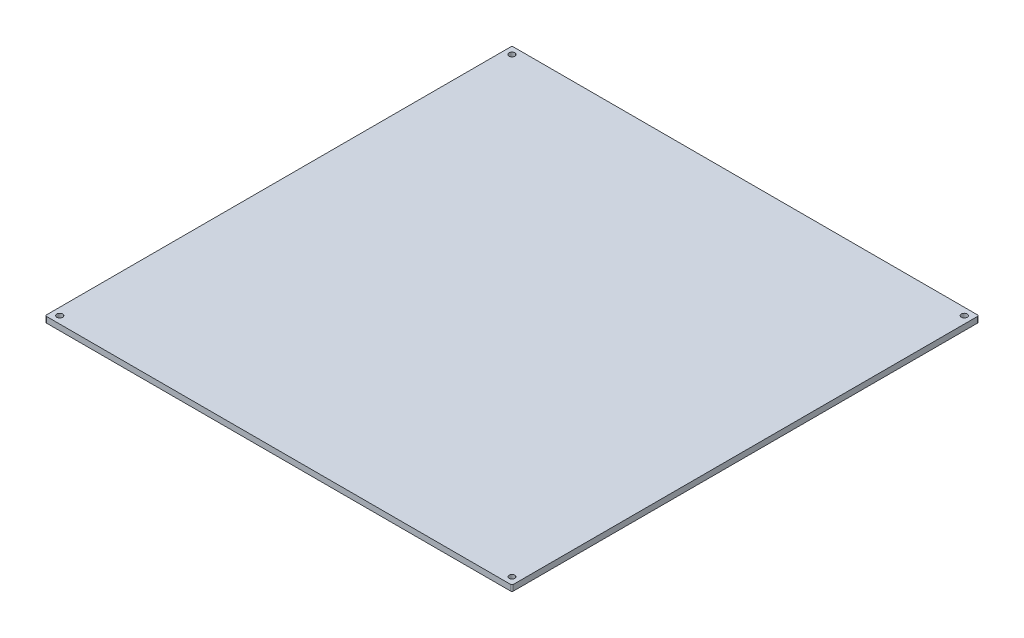
from build123d import *

# Parameters (mm, degrees)
SKETCH_1_R      = 2
EXTRUDE_1_DEPTH = 4


with BuildPart() as part:
    # Эскиз1 → Бобышка-Вытянуть1 (new body)
    with BuildSketch(Plane(origin=(0, 0, 0), x_dir=(1, 0, 0), z_dir=(0, 1, 0))):
        with BuildLine():
            Line((-159, -160), (159, -160))
            ThreePointArc((159, -160), (159.707106781, -159.707106781), (160, -159))
            Line((160, -159), (160, 159))
            ThreePointArc((160, 159), (159.707106781, 159.707106781), (159, 160))
            Line((159, 160), (-159, 160))
            ThreePointArc((-159, 160), (-159.707106781, 159.707106781), (-160, 159))
            Line((-160, 159), (-160, -159))
            ThreePointArc((-160, -159), (-159.707106781, -159.707106781), (-159, -160))
        make_face()
        with Locations(Location((-155, 155, 0), (0, 0, 270))):
            Circle(SKETCH_1_R, mode=Mode.SUBTRACT)
        with Locations(Location((155, 155, 0), (0, 0, 270))):
            Circle(SKETCH_1_R, mode=Mode.SUBTRACT)
        with Locations(Location((-155, -155, 0), (0, 0, 270))):
            Circle(SKETCH_1_R, mode=Mode.SUBTRACT)
        with Locations(Location((155, -155, 0), (0, 0, 270))):
            Circle(SKETCH_1_R, mode=Mode.SUBTRACT)
    extrude(amount=EXTRUDE_1_DEPTH)


solid = part.part
